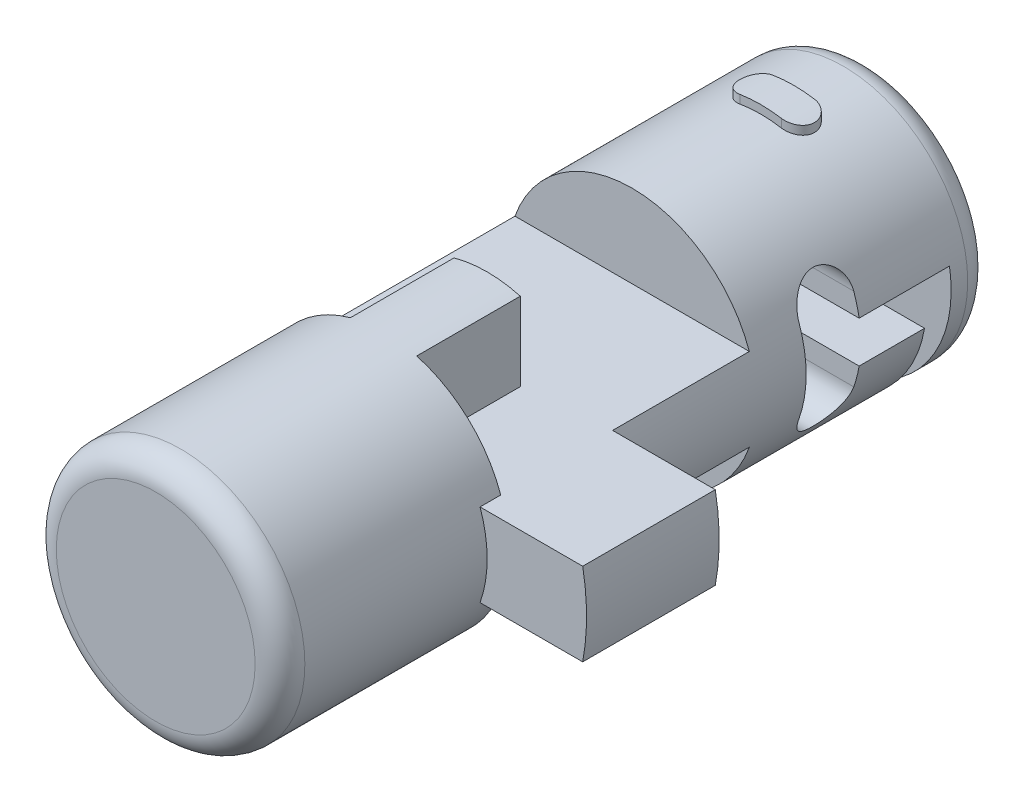
from build123d import *

# Parameters (mm, degrees)
SKETCH1_R                = 3.81
BOSS_EXTRUDE1_DEPTH      = 10.922
CUT_EXTRUDE1_DEPTH       = 13.633787397
CUT_EXTRUDE2_DEPTH       = 10.922
BOSS_EXTRUDE2_REACH      = 14.179
BOSS_EXTRUDE2_END_RADIUS = 6.858
SKETCH4_W                = 4.064
SKETCH4_H                = 2.54
BOSS_EXTRUDE3_REACH      = 15.641
BOSS_EXTRUDE3_END_RADIUS = 4.064
FILLET1_R                = 0.762


with BuildPart() as part:
    # Sketch1 → Boss-Extrude1 (new, symmetric)
    with BuildSketch(Plane.XY):
        Circle(SKETCH1_R)
    extrude(amount=BOSS_EXTRUDE1_DEPTH, both=True)

    # Sketch2 → Cut-Extrude1 (cut, through all)
    with BuildSketch(Plane(origin=(0, 1.27, 0), x_dir=(1, 0, 0), z_dir=(0, 1, 0))):
        Polygon((-3.81, 3.683), (3.81, 3.683), (3.81, -3.937), (1.016, -3.937), (1.016, -0.762), (-1.016, -0.762), (-1.016, -3.937), (-3.81, -3.937), align=None)
    cut_extrude1 = extrude(amount=CUT_EXTRUDE1_DEPTH, mode=Mode.SUBTRACT)

    # Mirror1: Cut-Extrude1 across plane
    add(cut_extrude1.mirror(Plane.ZX), mode=Mode.SUBTRACT)

    # Sketch3 → Cut-Extrude2 (cut, symmetric)
    with BuildSketch(Plane(origin=(0, 0, 0), x_dir=(0, 0, -1), z_dir=(1, 0, 0))):
        with BuildLine():
            Line((5.207, -1.27), (5.207, 1.27))
            ThreePointArc((5.207, 1.27), (6.045841446, 2.108841446), (6.884682892, 1.27))
            Line((6.884682892, 1.27), (6.884682892, 0.635))
            Line((6.884682892, 0.635), (9.652, 0.635))
            Line((9.652, 0.635), (9.652, -3.81))
            Line((9.652, -3.81), (8.89, -3.81))
            Line((8.89, -3.81), (8.89, -0.635))
            Line((8.89, -0.635), (6.884682892, -0.635))
            Line((6.884682892, -0.635), (6.884682892, -1.27))
            ThreePointArc((6.884682892, -1.27), (6.045841446, -2.108841446), (5.207, -1.27))
        make_face()
    extrude(amount=CUT_EXTRUDE2_DEPTH, both=True, mode=Mode.SUBTRACT)

    # Boss-Extrude2: up to this cylinder (the profile starts inside it)
    boss_extrude2_end = Plane(origin=(0, 0, 2.54), z_dir=(0, 0, -1)) * Cylinder(BOSS_EXTRUDE2_END_RADIUS, 43.074, mode=Mode.PRIVATE)
    # Sketch4 → Boss-Extrude2 (add, up to the surface)
    with BuildSketch(Plane(origin=(0, 0, 0), x_dir=(0, 0, -1), z_dir=(1, 0, 0)), mode=Mode.PRIVATE) as boss_extrude2_sk1:
        with Locations((-2.54, 0)):
            Rectangle(SKETCH4_W, SKETCH4_H)
    boss_extrude2_tool1 = extrude(boss_extrude2_sk1.sketch, amount=BOSS_EXTRUDE2_REACH, mode=Mode.PRIVATE) & boss_extrude2_end
    add(boss_extrude2_tool1.solids().sort_by_distance((0, 0, 2.54))[0])

    # Boss-Extrude3: up to this cylinder (the profile starts inside it)
    boss_extrude3_end = Plane(origin=(0, 0, -8.128), z_dir=(0, 0, -1)) * Cylinder(BOSS_EXTRUDE3_END_RADIUS, 40.41, mode=Mode.PRIVATE)
    # Sketch5 → Boss-Extrude3 (add, up to the surface)
    with BuildSketch(Plane(origin=(0, 0.635, 0), x_dir=(1, 0, 0), z_dir=(0, 1, 0)), mode=Mode.PRIVATE) as boss_extrude3_sk1:
        with BuildLine():
            Line((-0.635, 8.636), (0.635, 8.636))
            ThreePointArc((0.635, 8.636), (1.143, 8.128), (0.635, 7.62))
            Line((0.635, 7.62), (-0.635, 7.62))
            ThreePointArc((-0.635, 7.62), (-1.143, 8.128), (-0.635, 8.636))
        make_face()
    boss_extrude3_tool1 = extrude(boss_extrude3_sk1.sketch, amount=BOSS_EXTRUDE3_REACH, mode=Mode.PRIVATE) & boss_extrude3_end
    boss_extrude3 = boss_extrude3_tool1.solids().sort_by_distance((0, 0.635, -8.128))[0]
    add(boss_extrude3)

    # Mirror2: Boss-Extrude3 across plane
    add(boss_extrude3.mirror(Plane.ZX))

    # Fillet1
    fillet1_edges = [part.edges().sort_by_distance(p)[0] for p in [
        (-3.81, 0, -10.922),
        (-3.81, 0, 10.922),
    ]]
    fillet(fillet1_edges, radius=FILLET1_R)


solid = part.part
